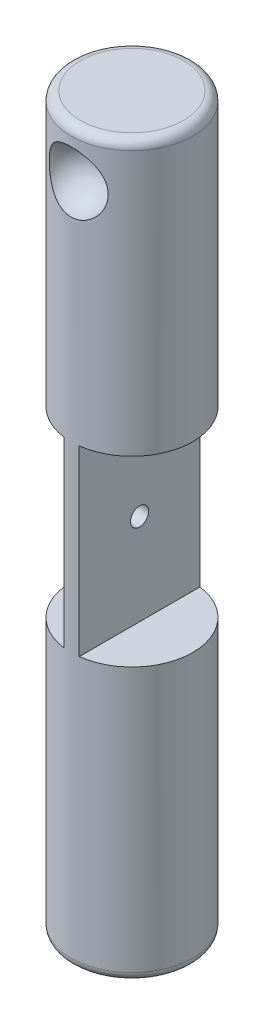
from build123d import *

# Parameters (mm, degrees)
SKETCH1_R               = 20
BOSS_EXTRUDE1_DEPTH     = 120
CUT_EXTRUDE5_DEPTH      = 124.288280059
CUT_EXTRUDE5_DEPTH_BACK = 124.288280059
SKETCH2_W               = 17.5
SKETCH2_H               = 60
SKETCH2_W_2             = 24.890093951
CUT_EXTRUDE7_DEPTH      = 124.718430317
CUT_EXTRUDE7_DEPTH_BACK = 124.718430317
SKETCH6_R               = 3
FILLET1_R               = 3


with BuildPart() as part:
    # Sketch1 → Boss-Extrude1 (new, symmetric)
    with BuildSketch(Plane(origin=(0, 0, 0), x_dir=(1, 0, 0), z_dir=(0, 1, 0))):
        with Locations(Location((0, 0, 0), (0, 0, 270))):
            Circle(SKETCH1_R)
    extrude(amount=BOSS_EXTRUDE1_DEPTH, both=True)

    # Sketch2 → Cut-Extrude5 (cut, two sides: drawn at the far end of the back side and taken through both)
    with BuildSketch(Plane.XY.offset(-CUT_EXTRUDE5_DEPTH_BACK)):
        with Locations((-11.25, 0)):
            Rectangle(SKETCH2_W, SKETCH2_H)
        with Locations((14.945046976, 0)):
            Rectangle(SKETCH2_W_2, SKETCH2_H)
    extrude(amount=CUT_EXTRUDE5_DEPTH + CUT_EXTRUDE5_DEPTH_BACK, mode=Mode.SUBTRACT)

    # Sketch6 → Cut-Extrude7 (cut, two sides: drawn at the far end of the back side and taken through both)
    with BuildSketch(Plane(origin=(2.5, 0, 0), x_dir=(0, 0, -1), z_dir=(1, 0, 0)).offset(-CUT_EXTRUDE7_DEPTH_BACK)):
        Circle(SKETCH6_R)
    extrude(amount=CUT_EXTRUDE7_DEPTH + CUT_EXTRUDE7_DEPTH_BACK, mode=Mode.SUBTRACT)

    # Sketch7 → Cut-Revolve1 (revolve, cut)
    with BuildSketch(Plane(origin=(0, 0, 0), x_dir=(0, 0, -1), z_dir=(1, 0, 0))):
        with BuildLine():
            Line((-30, 104), (-10, 104))
            ThreePointArc((-10, 104), (-20, 94), (-30, 104))
        make_face()
    revolve(axis=Axis((0, 104, 30), (0, 0, -1)), mode=Mode.SUBTRACT)

    # Fillet1
    fillet1_edges = [part.edges().sort_by_distance(p)[0] for p in [
        (0, -120, -20),
        (0, 120, -20),
    ]]
    fillet(fillet1_edges, radius=FILLET1_R)


solid = part.part
